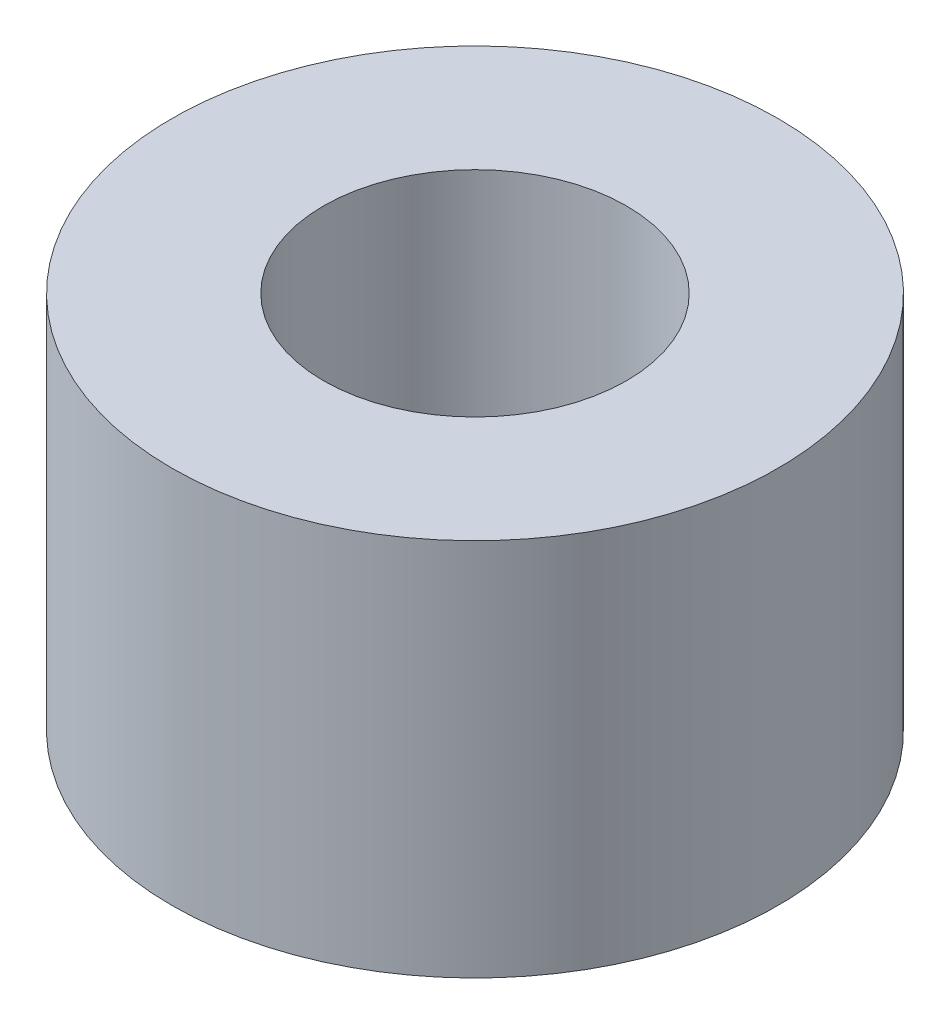
from build123d import *

# Parameters (mm, degrees)
SKETCH1_R           = 4
SKETCH1_R_2         = 2
BOSS_EXTRUDE1_DEPTH = 5


with BuildPart() as part:
    # Sketch1 → Boss-Extrude1 (new body)
    with BuildSketch(Plane(origin=(0, 0, 0), x_dir=(1, 0, 0), z_dir=(0, 1, 0))):
        with Locations(Location((5.584813224, 0, 0), (0, 0, 270))):
            Circle(SKETCH1_R)
        with Locations(Location((5.584813224, 0, 0), (0, 0, 270))):
            Circle(SKETCH1_R_2, mode=Mode.SUBTRACT)
    extrude(amount=BOSS_EXTRUDE1_DEPTH)


solid = part.part
